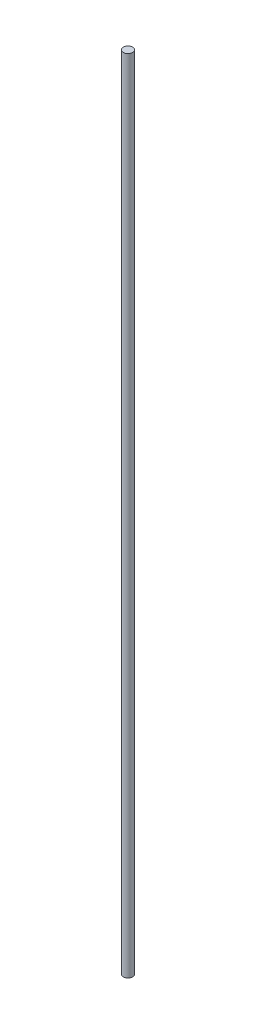
from build123d import *

# Parameters (mm, degrees)
SKETCH1_R           = 2
BOSS_EXTRUDE1_DEPTH = 344


with BuildPart() as part:
    # Sketch1 → Boss-Extrude1 (new body)
    with BuildSketch(Plane(origin=(0, 0, 0), x_dir=(1, 0, 0), z_dir=(0, 1, 0))):
        with Locations(Location((0, 0, 0), (0, 0, 270))):
            Circle(SKETCH1_R)
    extrude(amount=BOSS_EXTRUDE1_DEPTH)


solid = part.part
